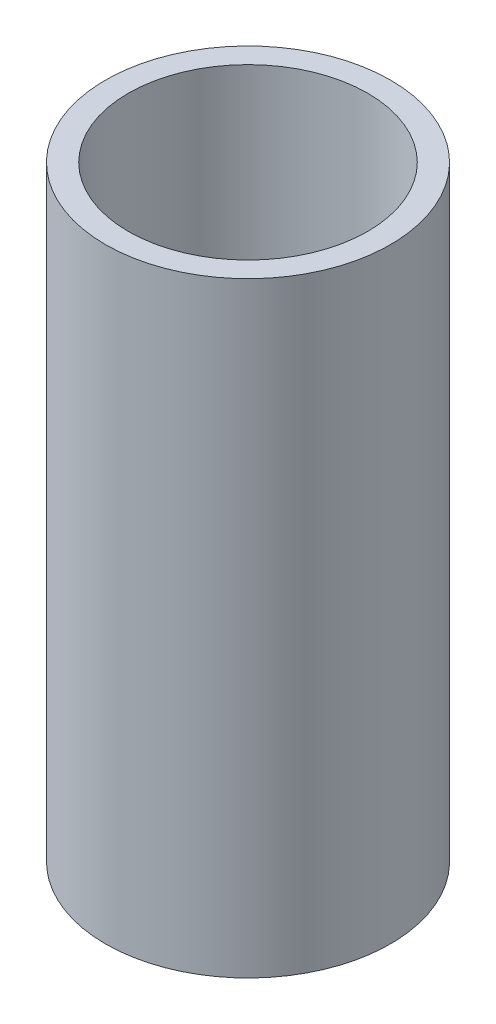
from build123d import *

# Parameters (mm, degrees)
SKETCH1_W = 2
SKETCH1_H = 53.12


with BuildPart() as part:
    # Sketch1 → Revolve1 (revolve)
    with BuildSketch(Plane.XY, mode=Mode.PRIVATE) as revolve1_sk:
        with Locations((11.5, 26.56)):
            Rectangle(SKETCH1_W, SKETCH1_H)
    revolve(revolve1_sk.sketch.rotate(Axis((0, 55.174459908, 0), (0, -1, 0)), 90), axis=Axis((0, 55.174459908, 0), (0, -1, 0)))


solid = part.part
